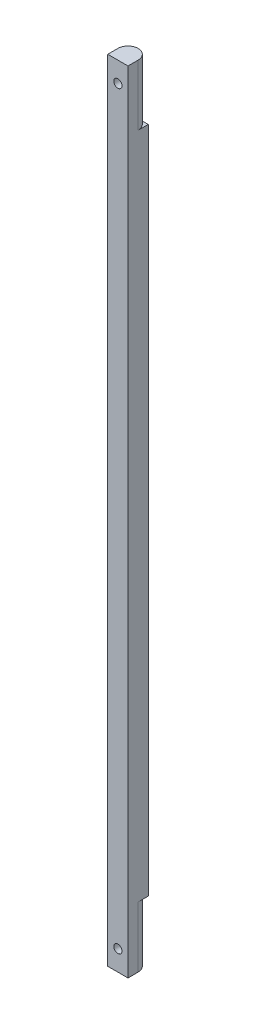
from build123d import *

# Parameters (mm, degrees)
BOSS_EXTRUDE1_DEPTH   = 123.825
F_5_40_TAPPED_HOLE1_D = 2.5781
BOSS_EXTRUDE2_START   = -19.05
SKETCH4_W             = 6.35
SKETCH4_H             = 6.35
BOSS_EXTRUDE2_DEPTH   = 209.55


with BuildPart() as part:
    # Sketch1 → Boss-Extrude1 (new, symmetric)
    with BuildSketch(Plane(origin=(0, 0, 0), x_dir=(1, 0, 0), z_dir=(0, 1, 0))):
        with BuildLine():
            Line((-3.175, 3.175), (-3.175, 0))
            Line((-3.175, 0), (3.175, 0))
            Line((3.175, 0), (3.175, 3.175))
            ThreePointArc((3.175, 3.175), (0, 6.35), (-3.175, 3.175))
        make_face()
    extrude(amount=BOSS_EXTRUDE1_DEPTH, both=True)

    # #5-40 Tapped Hole1 (through all)
    with Locations(Plane.XY):
        with Locations((0, -117.475)):
            f_5_40_tapped_hole1 = Hole(F_5_40_TAPPED_HOLE1_D / 2)

    # Mirror1: #5-40 Tapped Hole1 across plane
    add(f_5_40_tapped_hole1.mirror(Plane.ZX), mode=Mode.SUBTRACT)

    # Sketch4 → Boss-Extrude2 (add)
    with BuildSketch(Plane(origin=(0, 123.825, 0), x_dir=(1, 0, 0), z_dir=(0, 1, 0)).offset(BOSS_EXTRUDE2_START)):
        with Locations((0, 3.175)):
            Rectangle(SKETCH4_W, SKETCH4_H)
    extrude(amount=-BOSS_EXTRUDE2_DEPTH)


solid = part.part
